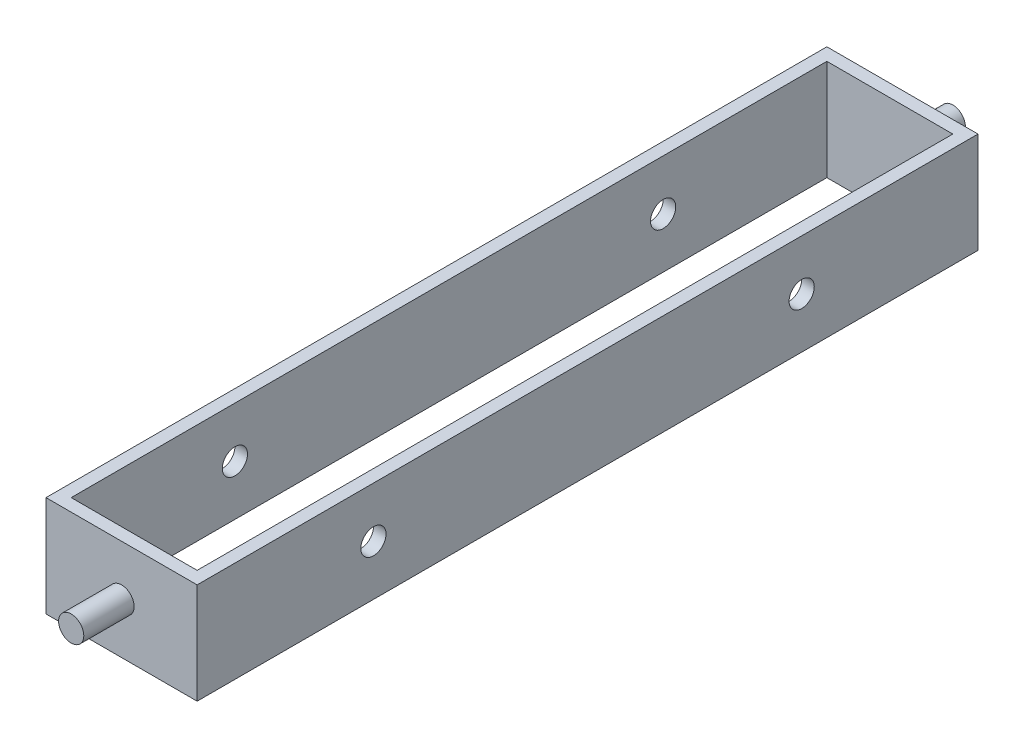
from build123d import *

# Parameters (mm, degrees)
SKETCH_7_R          = 5
EXTRUDE_5_DEPTH     = 20
SKETCH_8_W          = 60
SKETCH_8_H          = 40
EXTRUDE_7_DEPTH     = 5
SKETCH_9_W          = 5
SKETCH_9_H          = 40
EXTRUDE_8_DEPTH     = 300
SKETCH_10_W         = 60
SKETCH_10_H         = 40
EXTRUDE_9_DEPTH     = 5
SKETCH_11_R         = 5
EXTRUDE_10_DEPTH    = 20
SKETCH_12_R         = 5
CUT_EXTRUDE_1_DEPTH = 96


with BuildPart() as part:
    # Эскиз7 → Бобышка-Вытянуть5 (new body)
    with BuildSketch(Plane.XY):
        with Locations(Location((0, 0, 0), (0, 0, 180))):
            Circle(SKETCH_7_R)
    extrude(amount=EXTRUDE_5_DEPTH)

    # Эскиз8 → Бобышка-Вытянуть7 (add)
    with BuildSketch(Plane.XY.offset(20)):
        Rectangle(SKETCH_8_W, SKETCH_8_H)
    extrude(amount=EXTRUDE_7_DEPTH)

    # Эскиз9 → Бобышка-Вытянуть8 (add)
    with BuildSketch(Plane.XY.offset(25)):
        with Locations((-27.5, 0)):
            Rectangle(SKETCH_9_W, SKETCH_9_H)
        with Locations((27.5, 0)):
            Rectangle(SKETCH_9_W, SKETCH_9_H)
    extrude(amount=EXTRUDE_8_DEPTH)

    # Эскиз10 → Бобышка-Вытянуть9 (add)
    with BuildSketch(Plane.XY.offset(325)):
        Rectangle(SKETCH_10_W, SKETCH_10_H)
    extrude(amount=EXTRUDE_9_DEPTH)

    # Эскиз11 → Бобышка-Вытянуть10 (add)
    with BuildSketch(Plane.XY.offset(330)):
        with Locations(Location((0, 0, 0), (0, 0, 180))):
            Circle(SKETCH_11_R)
    extrude(amount=EXTRUDE_10_DEPTH)

    # Эскиз12 → Вырез-Вытянуть1 (cut)
    with BuildSketch(Plane(origin=(30, 0, 0), x_dir=(0, 0, -1), z_dir=(1, 0, 0))):
        with Locations((-90, 0)):
            Circle(SKETCH_12_R)
        with Locations(Location((-260, 0, 0), (0, 0, 90))):
            Circle(SKETCH_12_R)
    extrude(amount=-CUT_EXTRUDE_1_DEPTH, mode=Mode.SUBTRACT)


solid = part.part
